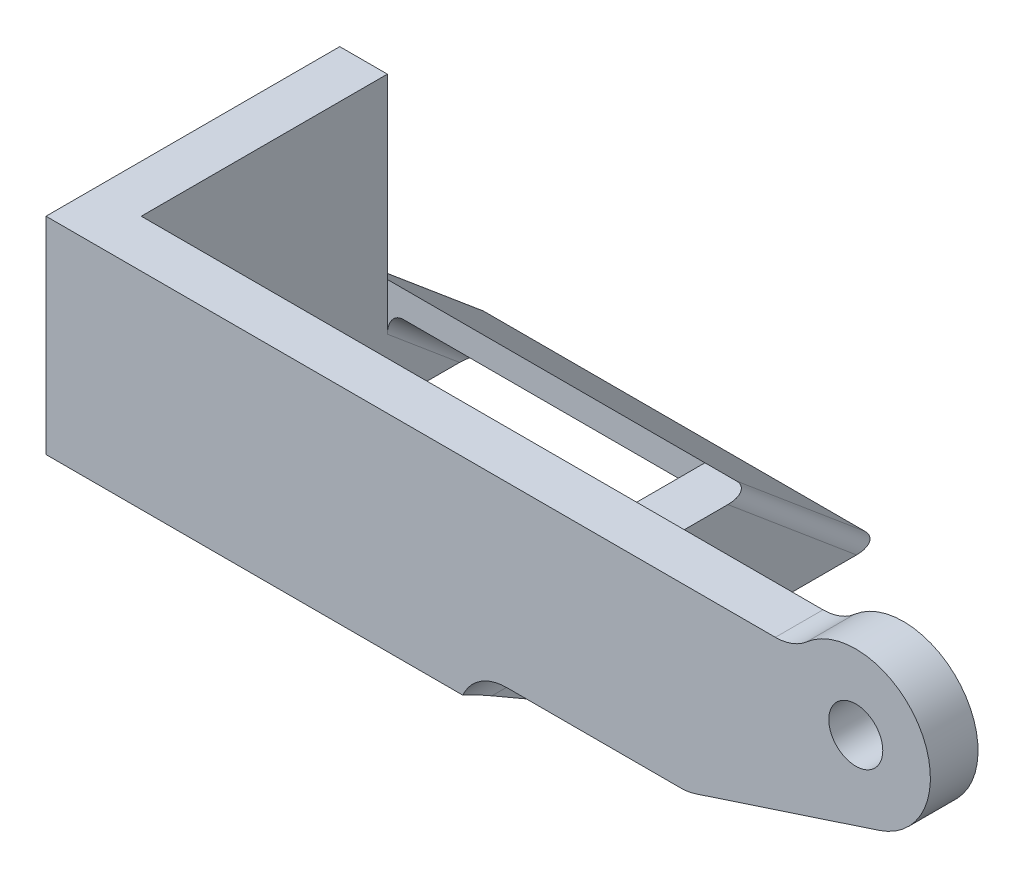
from build123d import *

# Parameters (mm, degrees)
SKETCH1_R           = 1.7
BOSS_EXTRUDE1_DEPTH = 3
BOSS_EXTRUDE2_DEPTH = 3
BOSS_EXTRUDE3_DEPTH = 20
BOSS_EXTRUDE4_DEPTH = 3
FILLET1_R           = 3
BOSS_EXTRUDE5_REACH = 38.788
BOSS_EXTRUDE6_DEPTH = 3
BOSS_EXTRUDE7_DEPTH = 3
FILLET3_R           = 1


with BuildPart() as part:
    # Sketch1 → Boss-Extrude1 (new body)
    with BuildSketch(Plane.XY):
        with BuildLine():
            Line((-3.774917218, 2.8), (-48, 2.8))
            Line((-48, 2.8), (-48, -10.2))
            Line((-48, -10.2), (-28, -10.2))
            Line((-28, -10.2), (-28, -8.4))
            Line((-28, -8.4), (-10.549988409, -8.4))
            Line((-10.549988409, -8.4), (1.462547038, -4.466649321))
            ThreePointArc((1.462547038, -4.466649321), (3.812848286, 2.748124442), (-3.774917218, 2.8))
        make_face()
        Circle(SKETCH1_R, mode=Mode.SUBTRACT)
    extrude(amount=BOSS_EXTRUDE1_DEPTH)

    # Sketch2 → Boss-Extrude2 (add)
    with BuildSketch(Plane.ZY.offset(48)):
        Polygon((-15.5, 2.8), (3, 2.8), (3, -10.2), (-5.660254038, -15.2), (-15.5, -15.2), align=None)
    extrude(amount=BOSS_EXTRUDE2_DEPTH)

    # Sketch3 → Boss-Extrude3 (add)
    with BuildSketch(Plane(origin=(-48, 0, 0), x_dir=(0, 0, -1), z_dir=(1, 0, 0))):
        Polygon((-3, -10.2), (0, -10.2), (13.737387097, -15.2), (5.660254038, -15.2), align=None)
    extrude(amount=BOSS_EXTRUDE3_DEPTH)

    # Sketch4 → Boss-Extrude4 (add)
    with BuildSketch(Plane(origin=(-28, 0, 0), x_dir=(0, 0, -1), z_dir=(1, 0, 0))):
        Polygon((-3, -10.2), (-3, -8.4), (15.5, -8.4), (15.5, -15.2), (5.660254038, -15.2), align=None)
    extrude(amount=BOSS_EXTRUDE4_DEPTH)

    # Fillet1
    fillet1_edges = [part.edges().sort_by_distance(p)[0] for p in [
        (-10.549988409, -8.4, 1.5),
        (-25, -8.4, 1.5),
        (-3.774917218, 2.8, 1.5),
    ]]
    fillet(fillet1_edges, radius=FILLET1_R)

    # Boss-Extrude5: up to this face of the body (flat: up to its plane)
    boss_extrude5_end = Plane(part.part.faces().sort_by_distance((-51, -5.690054126, -6.692488054))[0])
    # Sketch6 → Boss-Extrude5 (add, up to the picked face)
    with BuildSketch(Plane(origin=(-25, 0, 0), x_dir=(0, 0, -1), z_dir=(1, 0, 0)), mode=Mode.PRIVATE) as boss_extrude5_sk1:
        Polygon((15.5, -8.4), (23.60392443, -15.2), (21.60392443, -15.2), (15.5, -10.078199262), align=None)
    boss_extrude5_tool1 = split(extrude(boss_extrude5_sk1.sketch, amount=-BOSS_EXTRUDE5_REACH, mode=Mode.PRIVATE), bisect_by=boss_extrude5_end, keep=Keep.BOTH, mode=Mode.PRIVATE)
    add(boss_extrude5_tool1.solids().sort_by(Axis((-25, -12.199864, -19.075423), (-1, 0, 0)))[0])

    # Sketch7 → Boss-Extrude6 (add)
    with BuildSketch(Plane(origin=(-25, 0, 0), x_dir=(0, 0, -1), z_dir=(1, 0, 0))):
        Polygon((15.5, -15.2), (21.60392443, -15.2), (15.5, -10.078199262), align=None)
    extrude(amount=-BOSS_EXTRUDE6_DEPTH)

    # Sketch8 → Boss-Extrude7 (add)
    with BuildSketch(Plane.ZY.offset(51)):
        Polygon((-21.60392443, -15.2), (-15.5, -10.078199262), (-15.5, -15.2), align=None)
    extrude(amount=-BOSS_EXTRUDE7_DEPTH)

    # Fillet3
    fillet3_edges = [part.edges().sort_by_distance(p)[0] for p in [
        (-25, -11.8, -19.551962215),
        (-51, -11.8, -19.551962215),
        (-28, -12.639099631, -18.551962215),
        (-48, -12.639099631, -18.551962215),
        (-28, -12.7, -6.868693549),
        (-48, -12.7, -6.868693549),
        (-25, -9.9, 0),
    ]]
    fillet(fillet3_edges, radius=FILLET3_R)


solid = part.part
